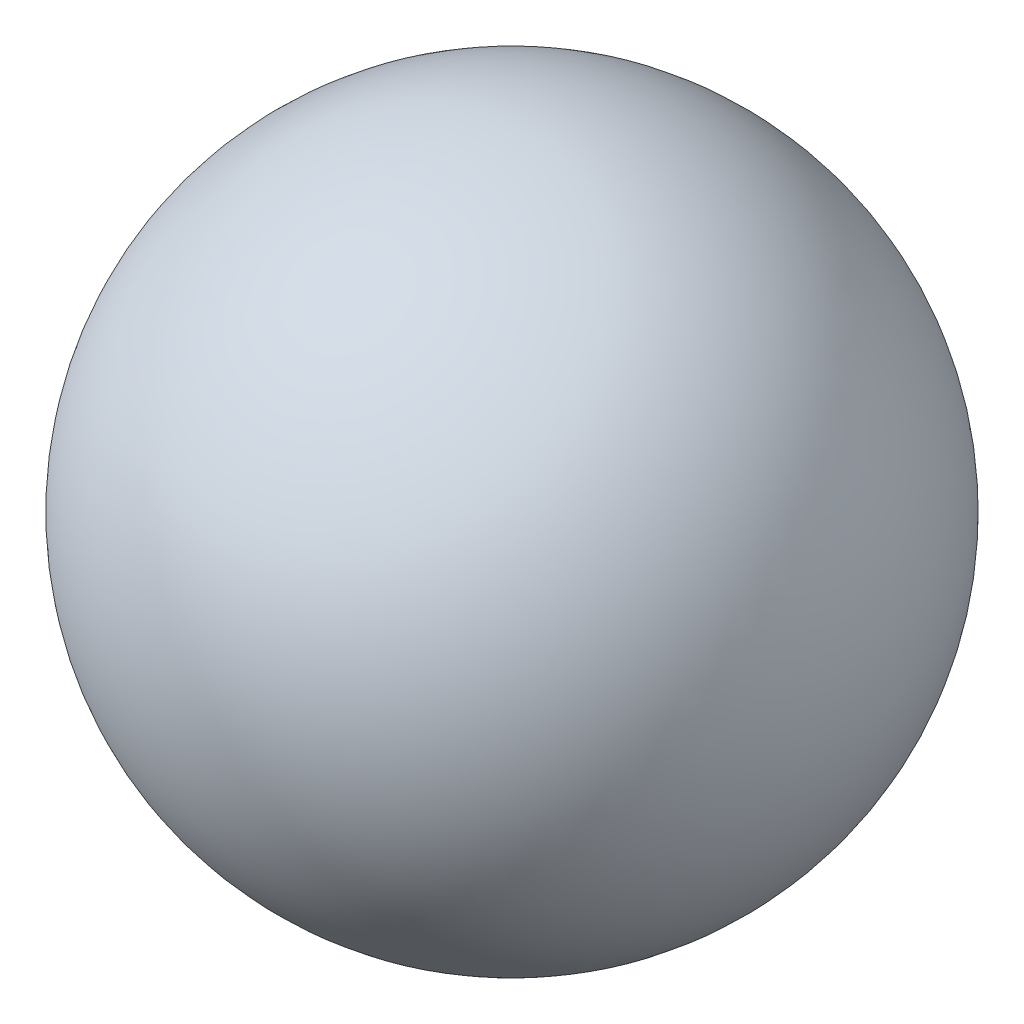
from build123d import *


with BuildPart() as part:
    # 草图1 → 旋转4 (revolve)
    with BuildSketch(Plane.XY):
        with BuildLine():
            Line((0, 20), (0, 18))
            ThreePointArc((0, 18), (18, 0), (0, -18))
            Line((0, -18), (0, -20))
            ThreePointArc((0, -20), (20, 0), (0, 20))
        make_face()
    revolve(axis=Axis((0, -1000, 0), (0, 1, 0)))


solid = part.part
